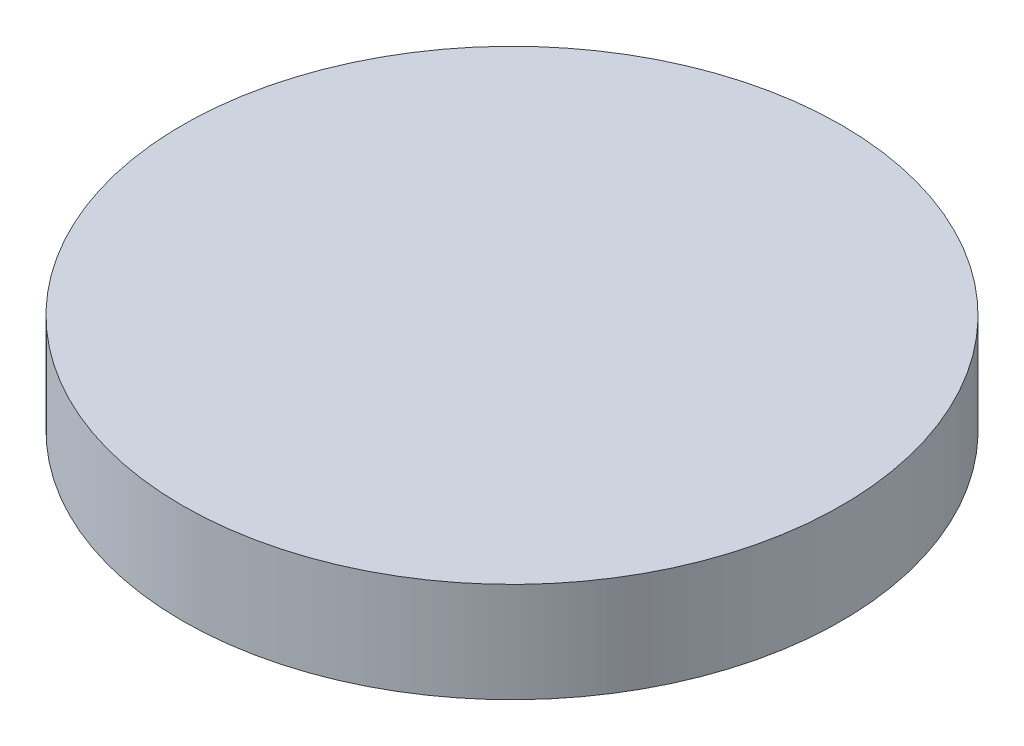
from build123d import *

# Parameters (mm, degrees)
BASE_SKETCH_R = 1.65
BASE_DEPTH    = 0.5


with BuildPart() as part:
    # Base Sketch → Base (new body)
    with BuildSketch(Plane(origin=(0, 0, 0), x_dir=(1, 0, 0), z_dir=(0, 1, 0))):
        with Locations(Location((0, 0, 0), (0, 0, 270))):
            Circle(BASE_SKETCH_R)
    extrude(amount=BASE_DEPTH)


solid = part.part
